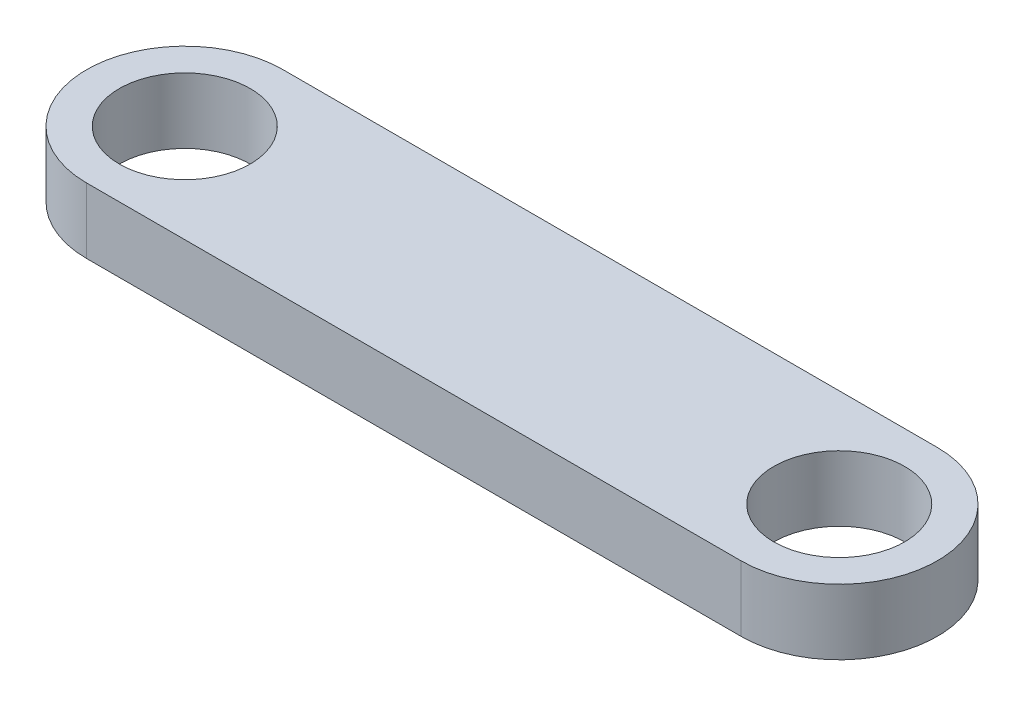
from build123d import *

# Parameters (mm, degrees)
SKETCH1_R           = 6.35
BOSS_EXTRUDE1_DEPTH = 6.35


with BuildPart() as part:
    # Sketch1 → Boss-Extrude1 (new body)
    with BuildSketch(Plane(origin=(0, 0, 0), x_dir=(1, 0, 0), z_dir=(0, 1, 0))):
        with BuildLine():
            Line((0, -9.525), (-63.5, -9.525))
            ThreePointArc((-63.5, -9.525), (-73.025, 0), (-63.5, 9.525))
            Line((-63.5, 9.525), (0, 9.525))
            ThreePointArc((0, 9.525), (9.525, 0), (0, -9.525))
        make_face()
        with Locations(Location((-63.5, 0, 0), (0, 0, 270))):
            Circle(SKETCH1_R, mode=Mode.SUBTRACT)
        with Locations(Location((0, 0, 0), (0, 0, 270))):
            Circle(SKETCH1_R, mode=Mode.SUBTRACT)
    extrude(amount=BOSS_EXTRUDE1_DEPTH)


solid = part.part
